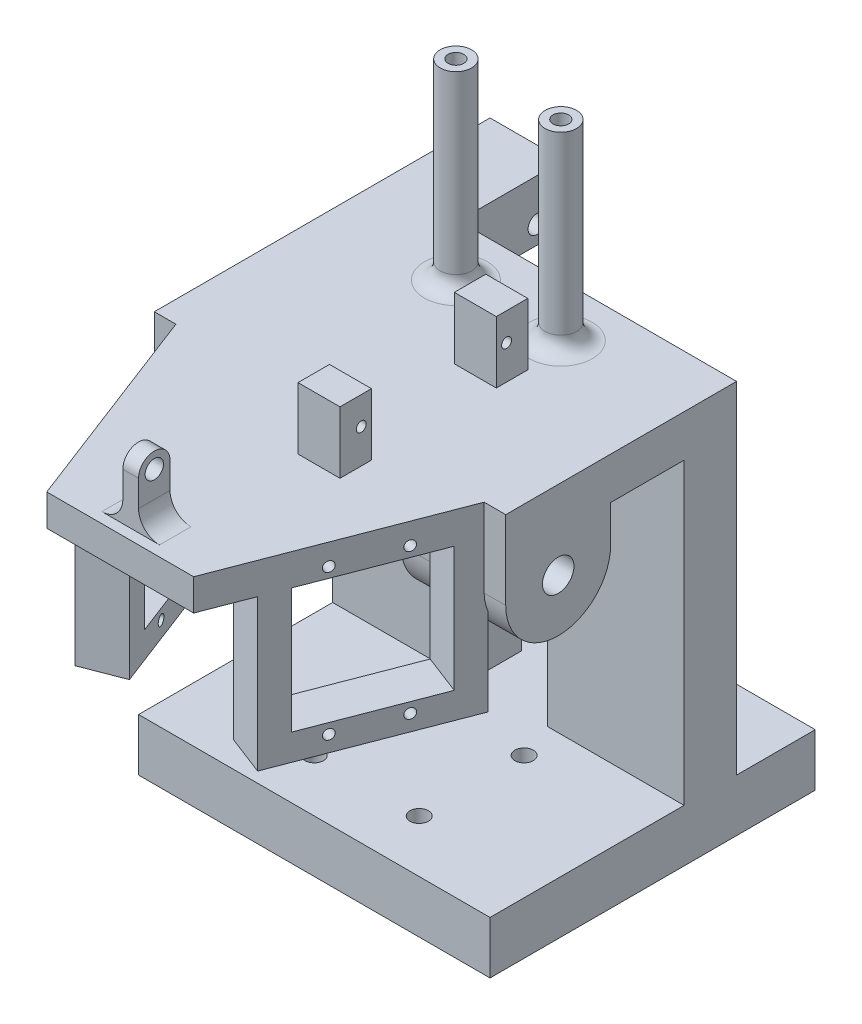
from build123d import *

# Parameters (mm, degrees)
SKETCH_1_W             = 67
SKETCH_1_H             = 62
EXTRUDE_1_DEPTH        = 10
SKETCH_3_W             = 14
SKETCH_3_H             = 20
EXTRUDE_2_DEPTH        = 12.5
SKETCH_4_W             = 10
SKETCH_4_H             = 65
EXTRUDE_3_DEPTH        = 67
SKETCH_5_W             = 67
SKETCH_5_H             = 44
EXTRUDE_4_DEPTH        = 8
EXTRUDE_5_DEPTH        = 20
CUT_EXTRUDE_START      = -6
CUT_EXTRUDE_1_DEPTH    = 8
EXTRUDE_6_DEPTH        = 6
SKETCH_9_R             = 3
CUT_EXTRUDE_2_DEPTH    = 23
SKETCH_10_W            = 24
SKETCH_10_H            = 23.8
EXTRUDE_7_DEPTH        = 8
SKETCH_12_W            = 14
SKETCH_12_H            = 20
EXTRUDE_8_DEPTH        = 11.5
SKETCH_13_R            = 0.95
CUT_EXTRUDE_4_DEPTH    = 8
SKETCH_14_W            = 8
SKETCH_14_H            = 6
EXTRUDE_9_DEPTH        = 11.8
SKETCH_15_R            = 0.95
CUT_EXTRUDE_5_DEPTH    = 11.8
SKETCH_16_W            = 3
SKETCH_16_H            = 6
EXTRUDE_10_DEPTH       = 12
FILLET_1_RADIUS        = 3
FILLET_1_LENGTH        = 3
SKETCH_17_R            = 1.75
CUT_EXTRUDE_6_DEPTH    = 7
SKETCH_18_R            = 3
EXTRUDE_11_DEPTH       = 36.5
FILLET_2_R             = 3
FILLET_2_OF_MIRROR_1_R = 3
SKETCH_20_R            = 1.75
CUT_EXTRUDE_7_DEPTH    = 35
SKETCH_21_W            = 15
SKETCH_21_H            = 55
CUT_EXTRUDE_8_DEPTH    = 35
SKETCH_24_R            = 1.75
CUT_EXTRUDE_11_DEPTH   = 18
SKETCH_25_R            = 1.5
CUT_EXTRUDE_12_DEPTH   = 10
FILLET_3_R             = 4
SKETCH_26_W            = 10.2
SKETCH_26_H            = 3.7
EXTRUDE_12_DEPTH       = 1
SKETCH_28_R            = 1.4
CUT_EXTRUDE_13_DEPTH   = 1


with BuildPart() as part:
    # 草图1 → 凸台-拉伸1 (new body)
    with BuildSketch(Plane(origin=(0, 0, 0), x_dir=(1, 0, 0), z_dir=(0, 1, 0))):
        Rectangle(SKETCH_1_W, SKETCH_1_H)
    extrude(amount=EXTRUDE_1_DEPTH)

    # 草图3 → 凸台-拉伸2 (add)
    with BuildSketch(Plane(origin=(0, 10, 0), x_dir=(1, 0, 0), z_dir=(0, 1, 0))):
        with Locations((-26.5, 26)):
            Rectangle(SKETCH_3_W, SKETCH_3_H)
    extrude(amount=EXTRUDE_2_DEPTH)

    # 草图4 → 凸台-拉伸3 (add)
    with BuildSketch(Plane.ZY.offset(33.5)):
        with Locations((-11, 42.5)):
            Rectangle(SKETCH_4_W, SKETCH_4_H)
    extrude(amount=-EXTRUDE_3_DEPTH)

    # 草图5 → 凸台-拉伸4 (add)
    with BuildSketch(Plane(origin=(0, 75, 0), x_dir=(1, 0, 0), z_dir=(0, 1, 0))):
        with Locations((0, -6)):
            Rectangle(SKETCH_5_W, SKETCH_5_H)
    extrude(amount=-EXTRUDE_4_DEPTH)

    # 草图6 → 凸台-拉伸5 (add)
    with BuildSketch(Plane(origin=(33.5, 0, 0), x_dir=(0, 0, -1), z_dir=(1, 0, 0))):
        with BuildLine():
            Line((-28, 60), (-28, 67))
            Line((-28, 67), (-8, 67))
            Line((-8, 67), (-8, 60))
            ThreePointArc((-8, 60), (-18, 50), (-28, 60))
        make_face()
    extrude_5 = extrude(amount=-EXTRUDE_5_DEPTH)

    # 草图7 → 切除-拉伸1 (cut)
    with BuildSketch(Plane(origin=(33.5, 0, 0), x_dir=(0, 0, -1), z_dir=(1, 0, 0)).offset(CUT_EXTRUDE_START)):
        with BuildLine():
            Line((-28, 60), (-28, 70.000230089))
            Line((-28, 70.000230089), (-8, 70.000230089))
            Line((-8, 70.000230089), (-8, 60))
            ThreePointArc((-8, 60), (-18, 50), (-28, 60))
        make_face()
    cut_extrude_1 = extrude(amount=-CUT_EXTRUDE_1_DEPTH, mode=Mode.SUBTRACT)

    # 草图8 → 凸台-拉伸6 (add)
    with BuildSketch(Plane(origin=(0, 75, 0), x_dir=(1, 0, 0), z_dir=(0, 1, 0))):
        Polygon((0, -68), (14, -68), (29.38527986, -28), (0, -28), align=None)
    extrude_6 = extrude(amount=-EXTRUDE_6_DEPTH)

    # 草图9 → 切除-拉伸2 (cut)
    with BuildSketch(Plane(origin=(33.5, 0, 0), x_dir=(0, 0, -1), z_dir=(1, 0, 0))):
        with Locations((-18, 60)):
            Circle(SKETCH_9_R)
    cut_extrude_2 = extrude(amount=-CUT_EXTRUDE_2_DEPTH, mode=Mode.SUBTRACT)

    # 草图10 → 凸台-拉伸7 (add)
    with BuildSketch(Plane(origin=(34.979976089, 0, 13.454418041), x_dir=(0.3589925858064443, 0, -0.933340411284116), z_dir=(0.9333404112841159, 0, 0.3589925858064442))):
        Polygon((-44, 75), (-15, 75), (-15, 40.2), (-43, 40.2), (-49, 40.2), (-49, 75), align=None)
        with Locations((-32, 57.1)):
            Rectangle(SKETCH_10_W, SKETCH_10_H, mode=Mode.SUBTRACT)
    extrude_7 = extrude(amount=-EXTRUDE_7_DEPTH)

    # 草图12 → 凸台-拉伸8 (add)
    with BuildSketch(Plane(origin=(0, 75, 0), x_dir=(1, 0, 0), z_dir=(0, 1, 0))):
        with Locations((-26.5, 26)):
            Rectangle(SKETCH_12_W, SKETCH_12_H)
    extrude(amount=-EXTRUDE_8_DEPTH)

    # 草图13 → 切除-拉伸4 (cut)
    with BuildSketch(Plane(origin=(27.513252799, 0, 10.582477354), x_dir=(-0.3589925858064441, 0, 0.9333404112841162), z_dir=(-0.9333404112841162, 0, -0.3589925858064441))):
        with Locations((38.5, 70.95)):
            Circle(SKETCH_13_R)
        with Locations((26.5, 70.95)):
            Circle(SKETCH_13_R)
        with Locations((26.5, 43.25)):
            Circle(SKETCH_13_R)
        with Locations((38.5, 43.25)):
            Circle(SKETCH_13_R)
    cut_extrude_4 = extrude(amount=-CUT_EXTRUDE_4_DEPTH, mode=Mode.SUBTRACT)

    # 草图14 → 凸台-拉伸9 (add)
    with BuildSketch(Plane(origin=(0, 75, 0), x_dir=(1, 0, 0), z_dir=(0, 1, 0))):
        with Locations((7.7, -5)):
            Rectangle(SKETCH_14_W, SKETCH_14_H)
        with Locations((7.7, -34.8)):
            Rectangle(SKETCH_14_W, SKETCH_14_H)
    extrude(amount=EXTRUDE_9_DEPTH)

    # 草图15 → 切除-拉伸5 (cut)
    with BuildSketch(Plane.ZY.offset(-3.7)):
        with Locations((33.75, 81.5)):
            Circle(SKETCH_15_R)
        with Locations((6.05, 81.5)):
            Circle(SKETCH_15_R)
    extrude(amount=-CUT_EXTRUDE_5_DEPTH, mode=Mode.SUBTRACT)

    # 草图16 → 凸台-拉伸10 (add)
    with BuildSketch(Plane(origin=(0, 75, 0), x_dir=(1, 0, 0), z_dir=(0, 1, 0))):
        with Locations((0, -63)):
            Rectangle(SKETCH_16_W, SKETCH_16_H)
    extrude(amount=EXTRUDE_10_DEPTH)

    # 圆角1: full round fillet: the end face becomes a half cylinder, R = half its width
    fillet_1_face = Plane((0, 87, 63), x_dir=(1, 0, 0), z_dir=(0, 1, 0))  # on the end face: x along it, z out of the body
    fillet_1_slab = fillet_1_face.offset(-FILLET_1_RADIUS / 2) * Box(FILLET_1_LENGTH, 2 * FILLET_1_RADIUS, FILLET_1_RADIUS, mode=Mode.PRIVATE)  # the body's end, R deep
    fillet_1_round = Plane((0, 84, 63), x_dir=(0, 1, 0), z_dir=(1, 0, 0)) * Cylinder(FILLET_1_RADIUS, FILLET_1_LENGTH, mode=Mode.PRIVATE)  # its axis R under the face
    add(fillet_1_slab - fillet_1_round, mode=Mode.SUBTRACT)

    # 草图17 → 切除-拉伸6 (cut)
    with BuildSketch(Plane.ZY.offset(1.5)):
        with Locations((63, 84)):
            Circle(SKETCH_17_R)
    extrude(amount=-CUT_EXTRUDE_6_DEPTH, mode=Mode.SUBTRACT)

    # 草图18 → 凸台-拉伸11 (add)
    with BuildSketch(Plane(origin=(0, 75, 0), x_dir=(1, 0, 0), z_dir=(0, 1, 0))):
        with Locations(Location((10, 6, 0), (0, 0, 270))):
            Circle(SKETCH_18_R)
    extrude_11 = extrude(amount=EXTRUDE_11_DEPTH)

    # 圆角2
    fillet_2_edges = [part.edges().sort_by_distance(p)[0] for p in [
        (10, 75, -9),
    ]]
    fillet(fillet_2_edges, radius=FILLET_2_R)

    # 镜向1: 凸台-拉伸5, 切除-拉伸1, 凸台-拉伸6, 切除-拉伸2, 凸台-拉伸7, 切除-拉伸4, 凸台-拉伸11 across plane
    add(extrude_5.mirror(Plane(origin=(0, 0, 0), x_dir=(0, 0, 1), z_dir=(1, 0, 0))))
    add(cut_extrude_1.mirror(Plane(origin=(0, 0, 0), x_dir=(0, 0, 1), z_dir=(1, 0, 0))), mode=Mode.SUBTRACT)
    add(extrude_6.mirror(Plane(origin=(0, 0, 0), x_dir=(0, 0, 1), z_dir=(1, 0, 0))))
    add(cut_extrude_2.mirror(Plane(origin=(0, 0, 0), x_dir=(0, 0, 1), z_dir=(1, 0, 0))), mode=Mode.SUBTRACT)
    add(extrude_7.mirror(Plane(origin=(0, 0, 0), x_dir=(0, 0, 1), z_dir=(1, 0, 0))))
    add(cut_extrude_4.mirror(Plane(origin=(0, 0, 0), x_dir=(0, 0, 1), z_dir=(1, 0, 0))), mode=Mode.SUBTRACT)
    add(extrude_11.mirror(Plane(origin=(0, 0, 0), x_dir=(0, 0, 1), z_dir=(1, 0, 0))))

    # 圆角2 of 镜向1
    fillet_2_of_mirror_1_edges = [part.edges().sort_by_distance(p)[0] for p in [
        (-10, 75, -9),
    ]]
    fillet(fillet_2_of_mirror_1_edges, radius=FILLET_2_OF_MIRROR_1_R)

    # 草图20 → 切除-拉伸7 (cut)
    with BuildSketch(Plane.ZY.offset(33.5)):
        with Locations((-31, 67)):
            Circle(SKETCH_20_R)
        with Locations((-21, 67)):
            Circle(SKETCH_20_R)
        with Locations((-31, 19)):
            Circle(SKETCH_20_R)
        with Locations((-21, 19)):
            Circle(SKETCH_20_R)
    extrude(amount=-CUT_EXTRUDE_7_DEPTH, mode=Mode.SUBTRACT)

    # 草图21 → 切除-拉伸8 (cut)
    with BuildSketch(Plane(origin=(0, 0, -16), x_dir=(-1, 0, 0), z_dir=(0, 0, -1))):
        with Locations((0, 37.5)):
            Rectangle(SKETCH_21_W, SKETCH_21_H)
    extrude(amount=-CUT_EXTRUDE_8_DEPTH, mode=Mode.SUBTRACT)

    # 草图24 → 切除-拉伸11 (cut)
    with BuildSketch(Plane(origin=(0, 10, 0), x_dir=(1, 0, 0), z_dir=(0, 1, 0))):
        with Locations(Location((-10, -21, 0), (0, 0, 270))):
            Circle(SKETCH_24_R)
        with Locations(Location((10, -21, 0), (0, 0, 270))):
            Circle(SKETCH_24_R)
        with Locations(Location((-10, -1, 0), (0, 0, 270))):
            Circle(SKETCH_24_R)
        with Locations(Location((10, -1, 0), (0, 0, 270))):
            Circle(SKETCH_24_R)
    extrude(amount=-CUT_EXTRUDE_11_DEPTH, mode=Mode.SUBTRACT)

    # 草图25 → 切除-拉伸12 (cut)
    with BuildSketch(Plane(origin=(0, 111.5, 0), x_dir=(1, 0, 0), z_dir=(0, 1, 0))):
        with Locations(Location((10, 6, 0), (0, 0, 270))):
            Circle(SKETCH_25_R)
        with Locations(Location((-10, 6, 0), (0, 0, 270))):
            Circle(SKETCH_25_R)
    extrude(amount=-CUT_EXTRUDE_12_DEPTH, mode=Mode.SUBTRACT)

    # 圆角3
    fillet_3_edges = [part.edges().sort_by_distance(p)[0] for p in [
        (-1.5, 75, 63),
        (1.5, 75, 63),
    ]]
    fillet(fillet_3_edges, radius=FILLET_3_R)

    # 草图26 → 凸台-拉伸12 (add)
    with BuildSketch(Plane.XZ.offset(-69)):
        with Locations((0, 62.45)):
            Rectangle(SKETCH_26_W, SKETCH_26_H)
    extrude(amount=EXTRUDE_12_DEPTH)

    # 草图28 → 切除-拉伸13 (cut)
    with BuildSketch(Plane.XZ.offset(-68)):
        with Locations(Location((0, 62.5, 0), (0, 0, 270))):
            Circle(SKETCH_28_R)
    extrude(amount=-CUT_EXTRUDE_13_DEPTH, mode=Mode.SUBTRACT)


solid = part.part
